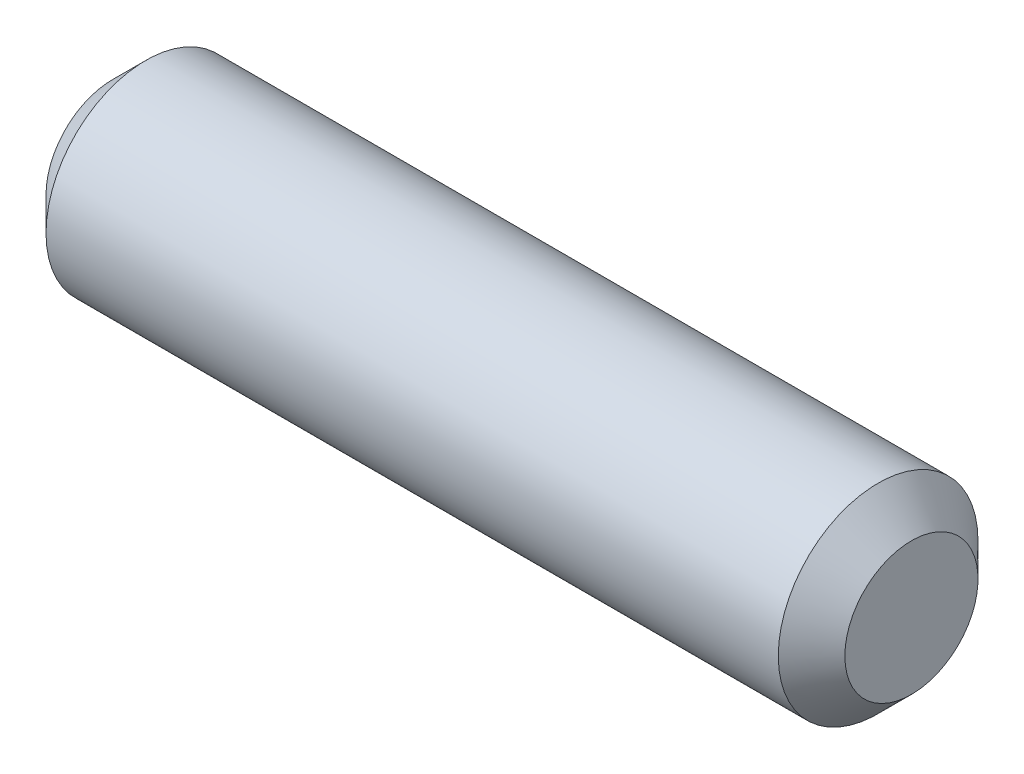
from build123d import *

# Parameters (mm, degrees)
SKETCH1_W     = 12
SKETCH1_H     = 1.5
CHAMFER1_SIZE = 0.5


with BuildPart() as part:
    # Sketch1 → Revolve1 (revolve)
    with BuildSketch(Plane.XY, mode=Mode.PRIVATE) as revolve1_sk:
        with Locations((0, 0.75)):
            Rectangle(SKETCH1_W, SKETCH1_H)
    revolve(revolve1_sk.sketch.rotate(Axis((-6, 0, 0), (1, 0, 0)), 90), axis=Axis((-6, 0, 0), (1, 0, 0)))

    # Chamfer1
    chamfer1_edges = [part.edges().sort_by_distance(p)[0] for p in [
        (-6, 0, -1.5),
        (6, 0, -1.5),
    ]]
    chamfer(chamfer1_edges, length=CHAMFER1_SIZE)


solid = part.part
